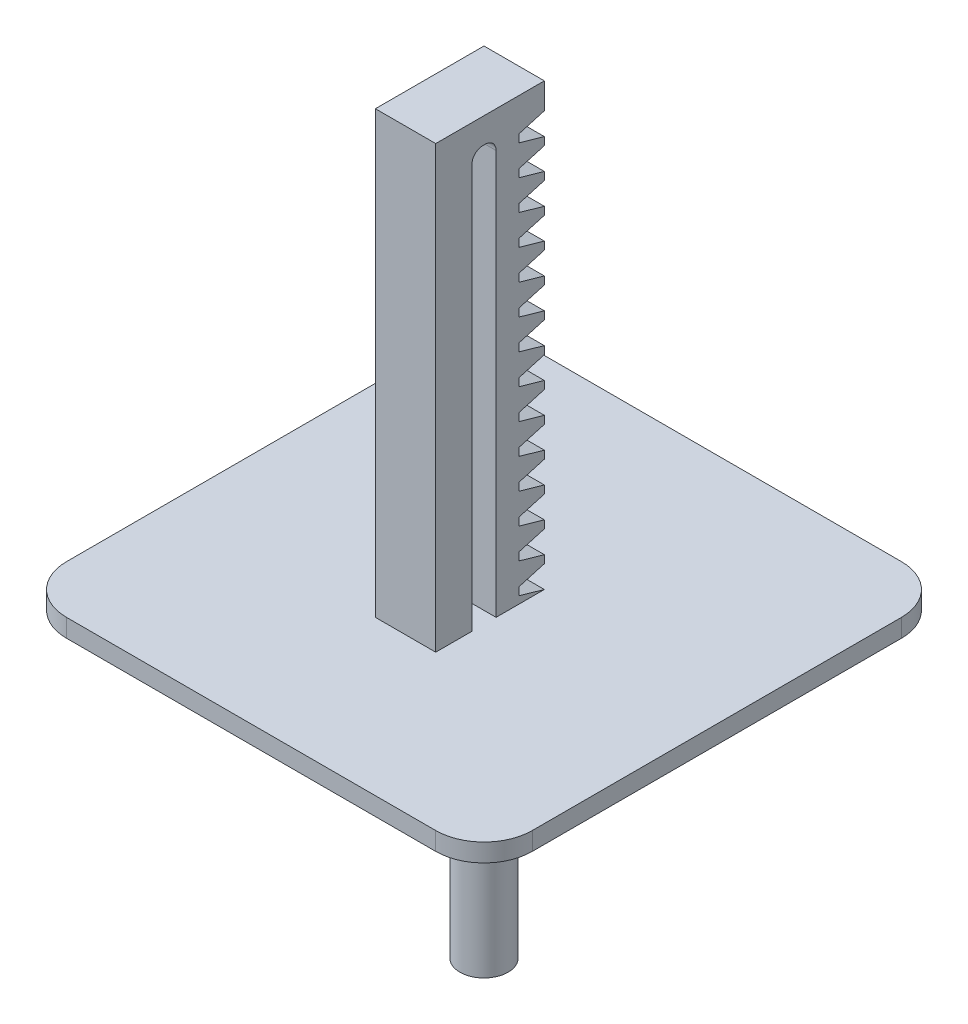
from build123d import *

# Parameters (mm, degrees)
DODANIE_WYCI_GNI_CIE1_DEPTH     = 1.5
SZKIC1_4_W                      = 5
SZKIC1_4_H                      = 9
DODANIE_WYCI_GNI_CIE2_DEPTH     = 38
SZKIC1_5_R                      = 2
DODANIE_WYCI_GNI_CIE3_DEPTH     = 11
SZKIC2_R                        = 0.85
WYTNIJ_WYCI_GNI_CIE3_DEPTH      = 9
WYTNIJ_WYCI_GNI_CIE4_DEPTH      = 48.867724512
WYTNIJ_WYCI_GNI_CIE4_DEPTH_BACK = 10
WYTNIJ_WYCI_GNI_CIE5_DEPTH      = 10


with BuildPart() as part:
    # Szkic1 → Dodanie-wyciągnięcie1 (new body)
    with BuildSketch(Plane(origin=(0, 0, 0), x_dir=(1, 0, 0), z_dir=(0, 1, 0))):
        with BuildLine():
            Line((15.295, -19.295), (-15.295, -19.295))
            ThreePointArc((-15.295, -19.295), (-18.123427125, -18.123427125), (-19.295, -15.295))
            Line((-19.295, -15.295), (-19.295, 15.295))
            ThreePointArc((-19.295, 15.295), (-18.123427125, 18.123427125), (-15.295, 19.295))
            Line((-15.295, 19.295), (15.295, 19.295))
            ThreePointArc((15.295, 19.295), (18.123427125, 18.123427125), (19.295, 15.295))
            Line((19.295, 15.295), (19.295, -15.295))
            ThreePointArc((19.295, -15.295), (18.123427125, -18.123427125), (15.295, -19.295))
        make_face()
    extrude(amount=DODANIE_WYCI_GNI_CIE1_DEPTH)

    # Szkic1<4> → Dodanie-wyciągnięcie2 (add)
    with BuildSketch(Plane(origin=(0, 0, 0), x_dir=(1, 0, 0), z_dir=(0, 1, 0))):
        with Locations((0, -2)):
            Rectangle(SZKIC1_4_W, SZKIC1_4_H)
    extrude(amount=DODANIE_WYCI_GNI_CIE2_DEPTH)

    # Szkic1<5> → Dodanie-wyciągnięcie3 (add)
    with BuildSketch(Plane(origin=(0, 0, 0), x_dir=(1, 0, 0), z_dir=(0, 1, 0))):
        with Locations(Location((13.965358928, -13.965358928, 0), (0, 0, 270))):
            Circle(SZKIC1_5_R)
        with Locations(Location((-13.965358928, 13.965358928, 0), (0, 0, 270))):
            Circle(SZKIC1_5_R)
    extrude(amount=-DODANIE_WYCI_GNI_CIE3_DEPTH)

    # Szkic2 → Wytnij-wyciągnięcie3 (cut)
    with BuildSketch(Plane(origin=(0, -11, 0), x_dir=(1, 0, 0), z_dir=(0, 1, 0))):
        with Locations(Location((-14, 14, 0), (0, 0, 270))):
            Circle(SZKIC2_R)
        with Locations(Location((14, -14, 0), (0, 0, 270))):
            Circle(SZKIC2_R)
    extrude(amount=WYTNIJ_WYCI_GNI_CIE3_DEPTH, mode=Mode.SUBTRACT)

    # Szkic4 → Wytnij-wyciągnięcie4 (cut, two sides: drawn at the far end of the back side and taken through both)
    with BuildSketch(Plane.ZY.offset(2.5).offset(-WYTNIJ_WYCI_GNI_CIE4_DEPTH_BACK)):
        Polygon((-2.5, 5.85), (-2.5, 4), (-0.4, 4.6), (-0.4, 5.25), align=None)
        Polygon((-0.4, 2.75), (-2.5, 3.35), (-2.5, 1.5), (-0.4, 2.1), align=None)
        Polygon((-2.5, 8.35), (-2.5, 6.5), (-0.4, 7.1), (-0.4, 7.75), align=None)
        Polygon((-2.5, 10.85), (-2.5, 9), (-0.4, 9.6), (-0.4, 10.25), align=None)
        Polygon((-2.5, 13.35), (-2.5, 11.5), (-0.4, 12.1), (-0.4, 12.75), align=None)
        Polygon((-2.5, 15.85), (-2.5, 14), (-0.4, 14.6), (-0.4, 15.25), align=None)
        Polygon((-0.4, 35.25), (-2.5, 35.85), (-2.5, 34), (-0.4, 34.6), align=None)
        Polygon((-2.5, 18.35), (-2.5, 16.5), (-0.4, 17.1), (-0.4, 17.75), align=None)
        Polygon((-0.4, 32.75), (-2.5, 33.35), (-2.5, 31.5), (-0.4, 32.1), align=None)
        Polygon((-2.5, 20.85), (-2.5, 19), (-0.4, 19.6), (-0.4, 20.25), align=None)
        Polygon((-0.4, 30.25), (-2.5, 30.85), (-2.5, 29), (-0.4, 29.6), align=None)
        Polygon((-2.5, 23.35), (-2.5, 21.5), (-0.4, 22.1), (-0.4, 22.75), align=None)
        Polygon((-0.4, 27.75), (-2.5, 28.35), (-2.5, 26.5), (-0.4, 27.1), align=None)
        Polygon((-2.5, 25.85), (-2.5, 24), (-0.4, 24.6), (-0.4, 25.25), align=None)
    extrude(amount=WYTNIJ_WYCI_GNI_CIE4_DEPTH + WYTNIJ_WYCI_GNI_CIE4_DEPTH_BACK, mode=Mode.SUBTRACT)

    # Szkic4<4> → Wytnij-wyciągnięcie5 (cut)
    with BuildSketch(Plane.ZY.offset(2.5)):
        with BuildLine():
            ThreePointArc((3.5, 35), (3.236396103, 35.636396103), (2.6, 35.9))
            Line((2.6, 35.9), (2.4, 35.9))
            ThreePointArc((2.4, 35.9), (1.763603897, 35.636396103), (1.5, 35))
            Line((1.5, 35), (1.5, 1.5))
            Line((1.5, 1.5), (3.5, 1.5))
            Line((3.5, 1.5), (3.5, 35))
        make_face()
    extrude(amount=-WYTNIJ_WYCI_GNI_CIE5_DEPTH, mode=Mode.SUBTRACT)


solid = part.part
